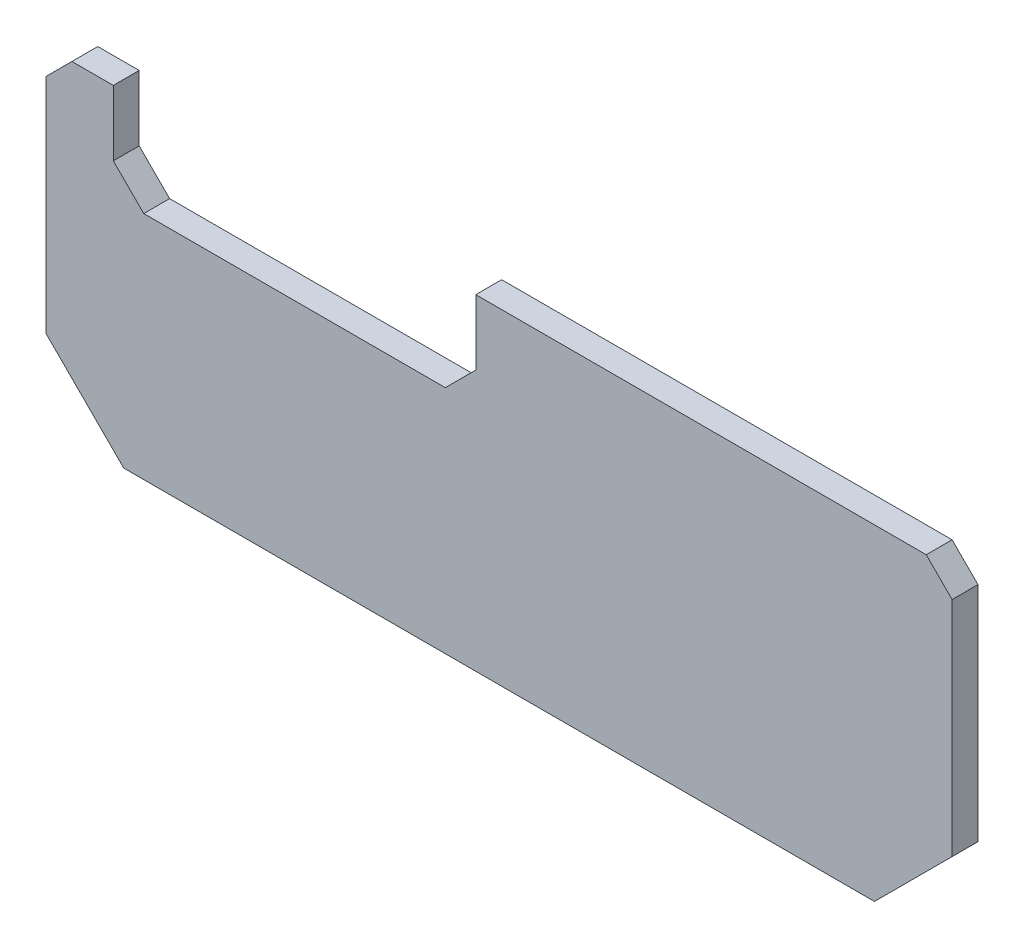
from build123d import *

# Parameters (mm, degrees)
SKETCH_1_W          = 175
SKETCH_1_H          = 63
EXTRUDE_1_DEPTH     = 5
CUT_EXTRUDE_1_REACH = 106.006
CHAMFER_1_SIZE      = 15
CHAMFER_2_SIZE      = 5


with BuildPart() as part:
    # 草图1 → 凸台-拉伸1 (new body)
    with BuildSketch(Plane.XY):
        with Locations((0, 24.5)):
            Rectangle(SKETCH_1_W, SKETCH_1_H)
    extrude(amount=EXTRUDE_1_DEPTH)

    # 草图2 → 切除-拉伸1 (cut, up to next)
    with BuildSketch(Plane.XY.offset(5), mode=Mode.PRIVATE) as cut_extrude_1_sk1:
        Polygon((-74.5, 56), (-4.5, 56), (-4.5, 43.378679656), (-10.378679656, 37.5), (-68.621320344, 37.5), (-74.5, 43.378679656), align=None)
    cut_extrude_1_tool1 = extrude(cut_extrude_1_sk1.sketch, amount=-CUT_EXTRUDE_1_REACH, mode=Mode.PRIVATE) & part.part
    add(cut_extrude_1_tool1.solids().sort_by_distance((-39.5, 46.94989, 5))[0], mode=Mode.SUBTRACT)

    # 倒角1
    chamfer_1_edges = [part.edges().sort_by_distance(p)[0] for p in [
        (87.5, -7, 2.5),
        (-87.5, -7, 2.5),
    ]]
    chamfer(chamfer_1_edges, length=CHAMFER_1_SIZE)

    # 倒角2
    chamfer_2_edges = [part.edges().sort_by_distance(p)[0] for p in [
        (-87.5, 56, 2.5),
        (87.5, 56, 2.5),
    ]]
    chamfer(chamfer_2_edges, length=CHAMFER_2_SIZE)


solid = part.part
